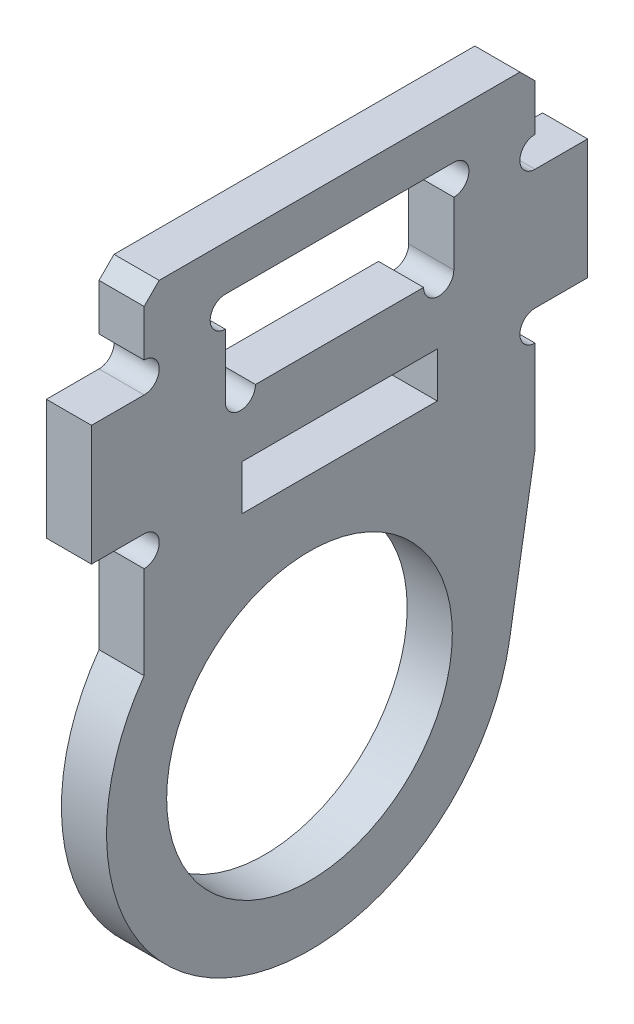
from build123d import *

# Parameters (mm, degrees)
SKETCH_1_R      = 9.5
SKETCH_1_W      = 13
SKETCH_1_H      = 3
EXTRUDE_1_DEPTH = 3
CHAMFER_1_SIZE  = 1


with BuildPart() as part:
    # 草图1 → 凸台-拉伸1 (new body)
    with BuildSketch(Plane(origin=(0, 0, 0), x_dir=(0, 0, -1), z_dir=(1, 0, 0))):
        with BuildLine():
            Line((13, 6.1), (-13, 6.1))
            Line((-13, 6.1), (-13, 2.01))
            ThreePointArc((-13, 2.01), (-12.289357685, 1.715642315), (-11.995, 1.005))
            ThreePointArc((-11.995, 1.005), (-12.289357685, 0.294357685), (-13, 0))
            Line((-13, 0), (-16.5, 0))
            Line((-16.5, 0), (-16.5, -8))
            Line((-16.5, -8), (-13, -8))
            ThreePointArc((-13, -8), (-12.289357685, -8.294357685), (-11.995, -9.005))
            ThreePointArc((-11.995, -9.005), (-12.289357685, -9.715642315), (-13, -10.01))
            Line((-13, -10.01), (-13, -16.173762079))
            ThreePointArc((-13, -16.173762079), (-7.16028893, -36.474831388), (11.314290923, -26.231514557))
            Line((11.314290923, -26.231514557), (13, -16.173762079))
            Line((13, -16.173762079), (13, -10.01))
            ThreePointArc((13, -10.01), (11.995, -9.005), (13, -8))
            Line((13, -8), (16.5, -8))
            Line((16.5, -8), (16.5, 0))
            Line((16.5, 0), (13, 0))
            ThreePointArc((13, 0), (11.995, 1.005), (13, 2.01))
            Line((13, 2.01), (13, 6.1))
        make_face()
        with Locations((-2, -24)):
            Circle(SKETCH_1_R, mode=Mode.SUBTRACT)
        with Locations((0, -8.6)):
            Rectangle(SKETCH_1_W, SKETCH_1_H, mode=Mode.SUBTRACT)
        with BuildLine():
            Line((5.59, -3.1), (-5.59, -3.1))
            ThreePointArc((-5.59, -3.1), (-6.595, -4.105), (-7.6, -3.1))
            Line((-7.6, -3.1), (-7.6, 1.09))
            ThreePointArc((-7.6, 1.09), (-8.605, 2.095), (-7.6, 3.1))
            Line((-7.6, 3.1), (7.6, 3.1))
            ThreePointArc((7.6, 3.1), (8.310642315, 2.805642315), (8.605, 2.095))
            ThreePointArc((8.605, 2.095), (8.310642315, 1.384357685), (7.6, 1.09))
            Line((7.6, 1.09), (7.6, -3.1))
            ThreePointArc((7.6, -3.1), (6.595, -4.105), (5.59, -3.1))
        make_face(mode=Mode.SUBTRACT)
    extrude(amount=EXTRUDE_1_DEPTH)

    # 倒角1
    chamfer_1_edges = [part.edges().sort_by_distance(p)[0] for p in [
        (1.5, 6.1, 13),
        (1.5, 6.1, -13),
    ]]
    chamfer(chamfer_1_edges, length=CHAMFER_1_SIZE)


solid = part.part
